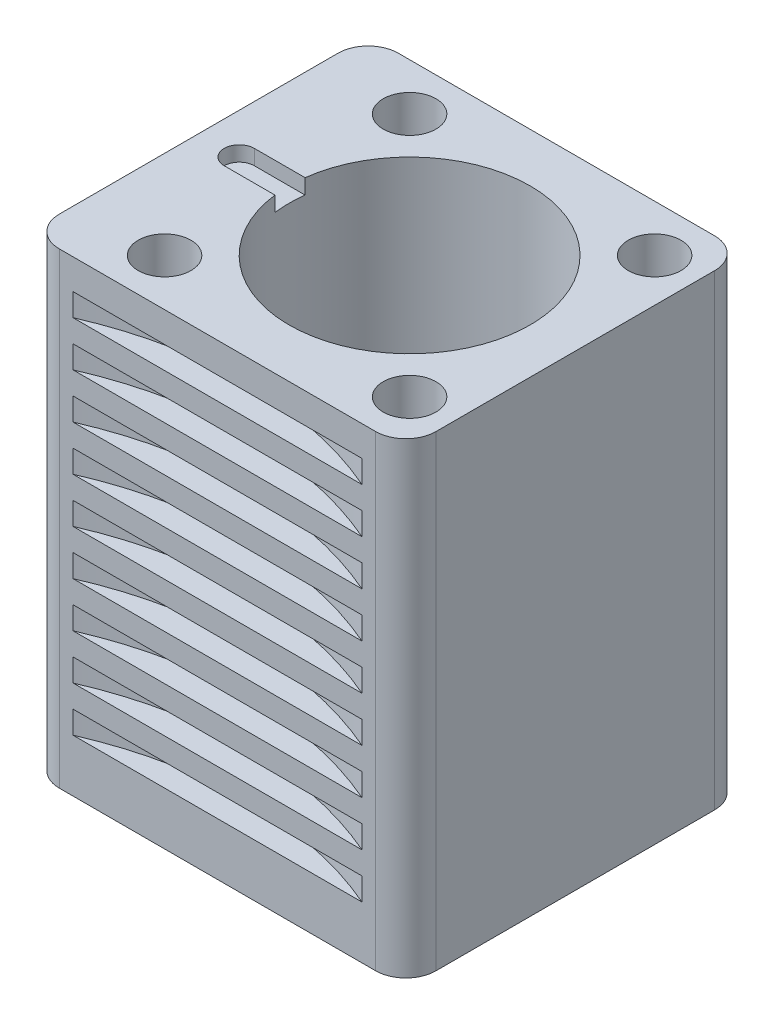
from build123d import *

# Parameters (mm, degrees)
BOSS_EXTRUDE1_DEPTH     = 62
SKETCH2_R               = 18
BOSS_EXTRUDE2_DEPTH     = 2
CUT_EXTRUDE1_DEPTH      = 74.391075752
CUT_EXTRUDE1_DEPTH_BACK = 74.391075752
SKETCH3_R               = 16
CUT_EXTRUDE2_DEPTH      = 2
SKETCH5_R               = 3.5
CUT_EXTRUDE3_DEPTH      = 74.391075752
SKETCH6_W               = 48
SKETCH6_H               = 3
LPATTERN2_COUNT         = 9
LPATTERN2_PITCH         = 6
MIRROR2_COPY_1_SKETCH_W = 48
MIRROR2_COPY_1_SKETCH_H = 3
MIRROR2_COPY_2_SKETCH_W = 48
MIRROR2_COPY_2_SKETCH_H = 3
MIRROR2_COPY_3_SKETCH_W = 48
MIRROR2_COPY_3_SKETCH_H = 3
MIRROR2_COPY_4_SKETCH_W = 48
MIRROR2_COPY_4_SKETCH_H = 3
MIRROR2_COPY_5_SKETCH_W = 48
MIRROR2_COPY_5_SKETCH_H = 3
MIRROR2_COPY_6_SKETCH_W = 48
MIRROR2_COPY_6_SKETCH_H = 3
MIRROR2_COPY_7_SKETCH_W = 48
MIRROR2_COPY_7_SKETCH_H = 3
MIRROR2_COPY_8_SKETCH_W = 48
MIRROR2_COPY_8_SKETCH_H = 3
SKETCH11_W              = 48
SKETCH11_H              = 3
LPATTERN4_COUNT         = 9
LPATTERN4_PITCH         = 6


with BuildPart() as part:
    # Sketch1 → Boss-Extrude1 (new body)
    with BuildSketch(Plane(origin=(0, 0, 0), x_dir=(1, 0, 0), z_dir=(0, 1, 0))):
        with BuildLine():
            Line((18, 22.5), (-24, 22.5))
            ThreePointArc((-24, 22.5), (-26.828427125, 21.328427125), (-28, 18.5))
            Line((-28, 18.5), (-28, -18.5))
            ThreePointArc((-28, -18.5), (-26.828427125, -21.328427125), (-24, -22.5))
            Line((-24, -22.5), (18, -22.5))
            ThreePointArc((18, -22.5), (20.828427125, -21.328427125), (22, -18.5))
            Line((22, -18.5), (22, 18.5))
            ThreePointArc((22, 18.5), (20.828427125, 21.328427125), (18, 22.5))
        make_face()
    extrude(amount=BOSS_EXTRUDE1_DEPTH)

    # Sketch2 → Boss-Extrude2 (add)
    with BuildSketch(Plane.XZ):
        with Locations(Location((0, 0, 0), (0, 0, 270))):
            Circle(SKETCH2_R)
    extrude(amount=BOSS_EXTRUDE2_DEPTH)

    # Sketch3 → Cut-Extrude1 (cut, two sides: drawn at the far end of the back side and taken through both)
    with BuildSketch(Plane(origin=(0, -2, 0), x_dir=(-1, 0, 0), z_dir=(0, -1, 0)).offset(-CUT_EXTRUDE1_DEPTH_BACK)):
        with Locations(Location((0, 0, 0), (0, 0, 90))):
            Circle(SKETCH3_R)
    extrude(amount=CUT_EXTRUDE1_DEPTH + CUT_EXTRUDE1_DEPTH_BACK, mode=Mode.SUBTRACT)

    # Sketch4 → Cut-Extrude2 (cut)
    with BuildSketch(Plane(origin=(0, 62, 0), x_dir=(1, 0, 0), z_dir=(0, 1, 0))):
        with BuildLine():
            Line((-9.037535931, 2), (-22.61, 2))
            ThreePointArc((-22.61, 2), (-24.61, 0), (-22.61, -2))
            Line((-22.61, -2), (-9.037535931, -2))
            Line((-9.037535931, -2), (-9.037535931, 2))
        make_face()
    extrude(amount=-CUT_EXTRUDE2_DEPTH, mode=Mode.SUBTRACT)

    # Sketch5 → Cut-Extrude3 (cut, through all)
    with BuildSketch(Plane(origin=(0, 62, 0), x_dir=(1, 0, 0), z_dir=(0, 1, 0))):
        with Locations(Location((16.263455967, 16.263455967, 0), (0, 0, 270))):
            Circle(SKETCH5_R)
        with Locations(Location((16.263455967, -16.263455967, 0), (0, 0, 270))):
            Circle(SKETCH5_R)
        with Locations(Location((-16.263455967, -16.263455967, 0), (0, 0, 270))):
            Circle(SKETCH5_R)
        with Locations(Location((-16.263455967, 16.263455967, 0), (0, 0, 270))):
            Circle(SKETCH5_R)
    extrude(amount=-CUT_EXTRUDE3_DEPTH, mode=Mode.SUBTRACT)

    # Sketch6 → Cut-Revolve2 (revolve, cut)
    with BuildSketch(Plane(origin=(-3, 0, 0), x_dir=(0, 0, -1), z_dir=(1, 0, 0))):
        with Locations((-42.5, 56.5)):
            Rectangle(SKETCH6_W, SKETCH6_H)
    cut_revolve2 = revolve(axis=Axis((-3, 58, 66.5), (0, -1, 0)), mode=Mode.SUBTRACT)

    # LPattern2: Cut-Revolve2 ×9
    with Locations(*[(0, -i * LPATTERN2_PITCH, 0) for i in range(1, LPATTERN2_COUNT)]):
        add(cut_revolve2, mode=Mode.SUBTRACT)

    # Mirror2: Cut-Revolve2 across plane
    add(cut_revolve2.mirror(Plane.XY), mode=Mode.SUBTRACT)

    # Mirror2 copy 1 sketch → Mirror2 copy 1 (revolve, cut)
    with BuildSketch(Plane(origin=(-3, -6, 0), x_dir=(0, 0, 1), z_dir=(1, 0, 0))):
        with Locations((-42.5, -56.5)):
            Rectangle(MIRROR2_COPY_1_SKETCH_W, MIRROR2_COPY_1_SKETCH_H)
    revolve(axis=Axis((-3, 52, -66.5), (0, 1, 0)), mode=Mode.SUBTRACT)

    # Mirror2 copy 2 sketch → Mirror2 copy 2 (revolve, cut)
    with BuildSketch(Plane(origin=(-3, -12, 0), x_dir=(0, 0, 1), z_dir=(1, 0, 0))):
        with Locations((-42.5, -56.5)):
            Rectangle(MIRROR2_COPY_2_SKETCH_W, MIRROR2_COPY_2_SKETCH_H)
    revolve(axis=Axis((-3, 46, -66.5), (0, 1, 0)), mode=Mode.SUBTRACT)

    # Mirror2 copy 3 sketch → Mirror2 copy 3 (revolve, cut)
    with BuildSketch(Plane(origin=(-3, -18, 0), x_dir=(0, 0, 1), z_dir=(1, 0, 0))):
        with Locations((-42.5, -56.5)):
            Rectangle(MIRROR2_COPY_3_SKETCH_W, MIRROR2_COPY_3_SKETCH_H)
    revolve(axis=Axis((-3, 40, -66.5), (0, 1, 0)), mode=Mode.SUBTRACT)

    # Mirror2 copy 4 sketch → Mirror2 copy 4 (revolve, cut)
    with BuildSketch(Plane(origin=(-3, -24, 0), x_dir=(0, 0, 1), z_dir=(1, 0, 0))):
        with Locations((-42.5, -56.5)):
            Rectangle(MIRROR2_COPY_4_SKETCH_W, MIRROR2_COPY_4_SKETCH_H)
    revolve(axis=Axis((-3, 34, -66.5), (0, 1, 0)), mode=Mode.SUBTRACT)

    # Mirror2 copy 5 sketch → Mirror2 copy 5 (revolve, cut)
    with BuildSketch(Plane(origin=(-3, -30, 0), x_dir=(0, 0, 1), z_dir=(1, 0, 0))):
        with Locations((-42.5, -56.5)):
            Rectangle(MIRROR2_COPY_5_SKETCH_W, MIRROR2_COPY_5_SKETCH_H)
    revolve(axis=Axis((-3, 28, -66.5), (0, 1, 0)), mode=Mode.SUBTRACT)

    # Mirror2 copy 6 sketch → Mirror2 copy 6 (revolve, cut)
    with BuildSketch(Plane(origin=(-3, -36, 0), x_dir=(0, 0, 1), z_dir=(1, 0, 0))):
        with Locations((-42.5, -56.5)):
            Rectangle(MIRROR2_COPY_6_SKETCH_W, MIRROR2_COPY_6_SKETCH_H)
    revolve(axis=Axis((-3, 22, -66.5), (0, 1, 0)), mode=Mode.SUBTRACT)

    # Mirror2 copy 7 sketch → Mirror2 copy 7 (revolve, cut)
    with BuildSketch(Plane(origin=(-3, -42, 0), x_dir=(0, 0, 1), z_dir=(1, 0, 0))):
        with Locations((-42.5, -56.5)):
            Rectangle(MIRROR2_COPY_7_SKETCH_W, MIRROR2_COPY_7_SKETCH_H)
    revolve(axis=Axis((-3, 16, -66.5), (0, 1, 0)), mode=Mode.SUBTRACT)

    # Mirror2 copy 8 sketch → Mirror2 copy 8 (revolve, cut)
    with BuildSketch(Plane(origin=(-3, -48, 0), x_dir=(0, 0, 1), z_dir=(1, 0, 0))):
        with Locations((-42.5, -56.5)):
            Rectangle(MIRROR2_COPY_8_SKETCH_W, MIRROR2_COPY_8_SKETCH_H)
    revolve(axis=Axis((-3, 10, -66.5), (0, 1, 0)), mode=Mode.SUBTRACT)

    # Sketch11 → Cut-Revolve4 (revolve, cut)
    with BuildSketch(Plane.XY):
        with Locations((-48, 56.5)):
            Rectangle(SKETCH11_W, SKETCH11_H)
    cut_revolve4 = revolve(axis=Axis((-72, 58, 0), (0, -1, 0)), mode=Mode.SUBTRACT)

    # LPattern4: Cut-Revolve4 ×9
    with Locations(*[(0, -i * LPATTERN4_PITCH, 0) for i in range(1, LPATTERN4_COUNT)]):
        add(cut_revolve4, mode=Mode.SUBTRACT)


solid = part.part
